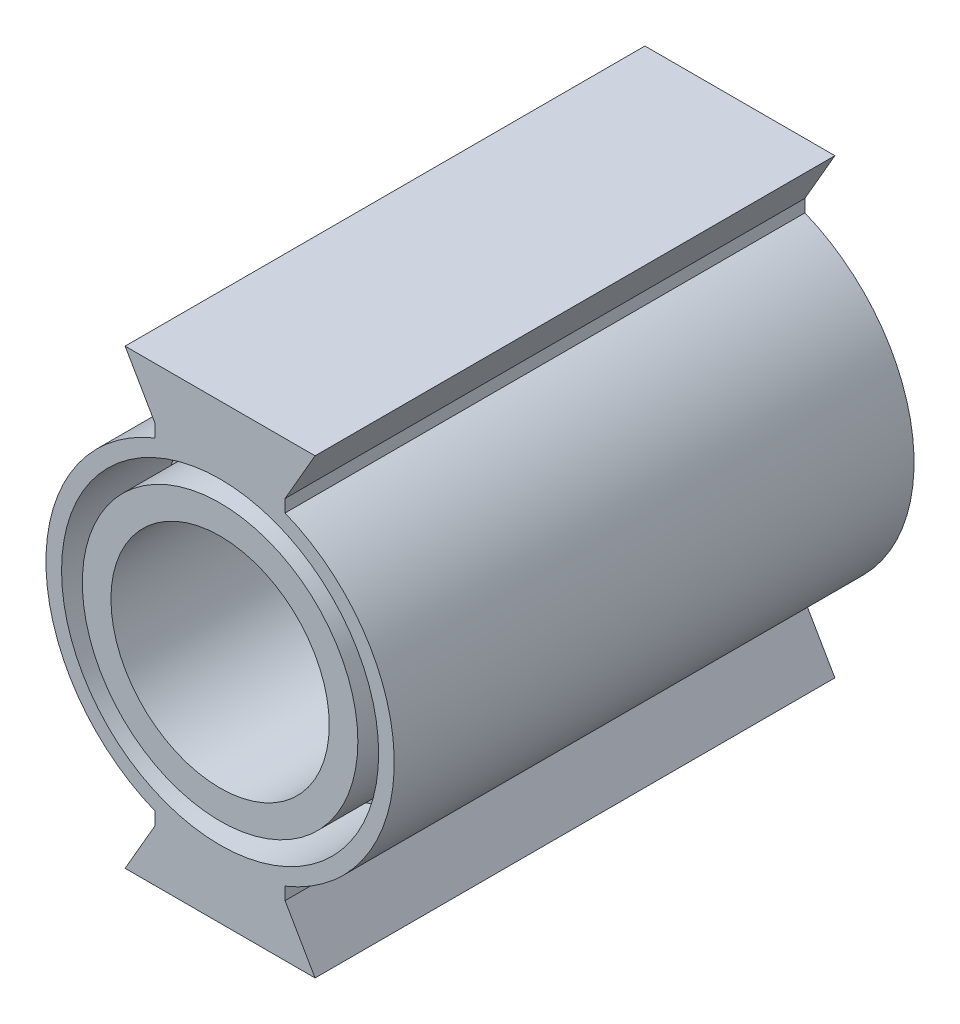
from build123d import *

# Parameters (mm, degrees)
SKETCH1_R           = 8.509
SKETCH1_R_2         = 5.334
BOSS_EXTRUDE1_DEPTH = 25.4
SKETCH2_R           = 7.747
SKETCH2_R_2         = 6.731
CUT_EXTRUDE1_DEPTH  = 5.08
BOSS_EXTRUDE2_DEPTH = 25.4


with BuildPart() as part:
    # Sketch1 → Boss-Extrude1 (new body)
    with BuildSketch(Plane.XY):
        Circle(SKETCH1_R)
        Circle(SKETCH1_R_2, mode=Mode.SUBTRACT)
    extrude(amount=BOSS_EXTRUDE1_DEPTH)

    # Sketch2 → Cut-Extrude1 (cut)
    with BuildSketch(Plane.XY.offset(25.4)):
        Circle(SKETCH2_R)
        Circle(SKETCH2_R_2, mode=Mode.SUBTRACT)
    extrude(amount=-CUT_EXTRUDE1_DEPTH, mode=Mode.SUBTRACT)

    # Sketch3 → Boss-Extrude2 (add)
    with BuildSketch(Plane.XY):
        with BuildLine():
            Line((-3.175, 7.894457296), (-3.175, 8.509))
            Line((-3.175, 8.509), (-4.641469684, 11.049))
            Line((-4.641469684, 11.049), (4.641469684, 11.049))
            Line((4.641469684, 11.049), (3.175, 8.509))
            Line((3.175, 8.509), (3.175, 7.894457296))
            ThreePointArc((3.175, 7.894457296), (0, 8.509), (-3.175, 7.894457296))
        make_face()
    boss_extrude2 = extrude(amount=BOSS_EXTRUDE2_DEPTH)

    # Mirror1: Boss-Extrude2 across plane
    add(boss_extrude2.mirror(Plane.ZX))


solid = part.part
